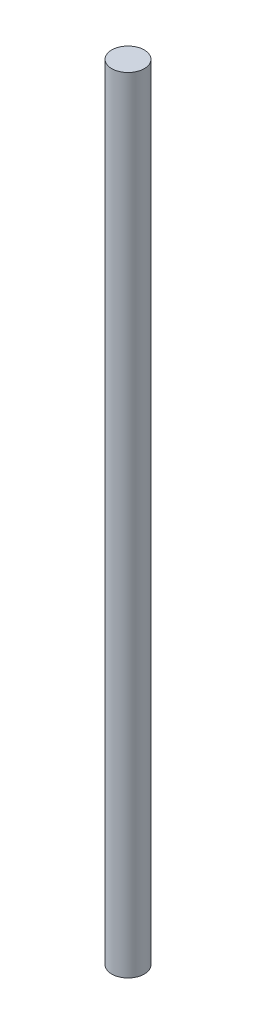
from build123d import *

# Parameters (mm, degrees)
SKETCH1_R           = 6.2
BOSS_EXTRUDE1_DEPTH = 299.5


with BuildPart() as part:
    # Sketch1 → Boss-Extrude1 (new body)
    with BuildSketch(Plane(origin=(0, 0, 0), x_dir=(1, 0, 0), z_dir=(0, 1, 0))):
        with Locations(Location((0, 0, 0), (0, 0, 270))):
            Circle(SKETCH1_R)
    extrude(amount=BOSS_EXTRUDE1_DEPTH)


solid = part.part
